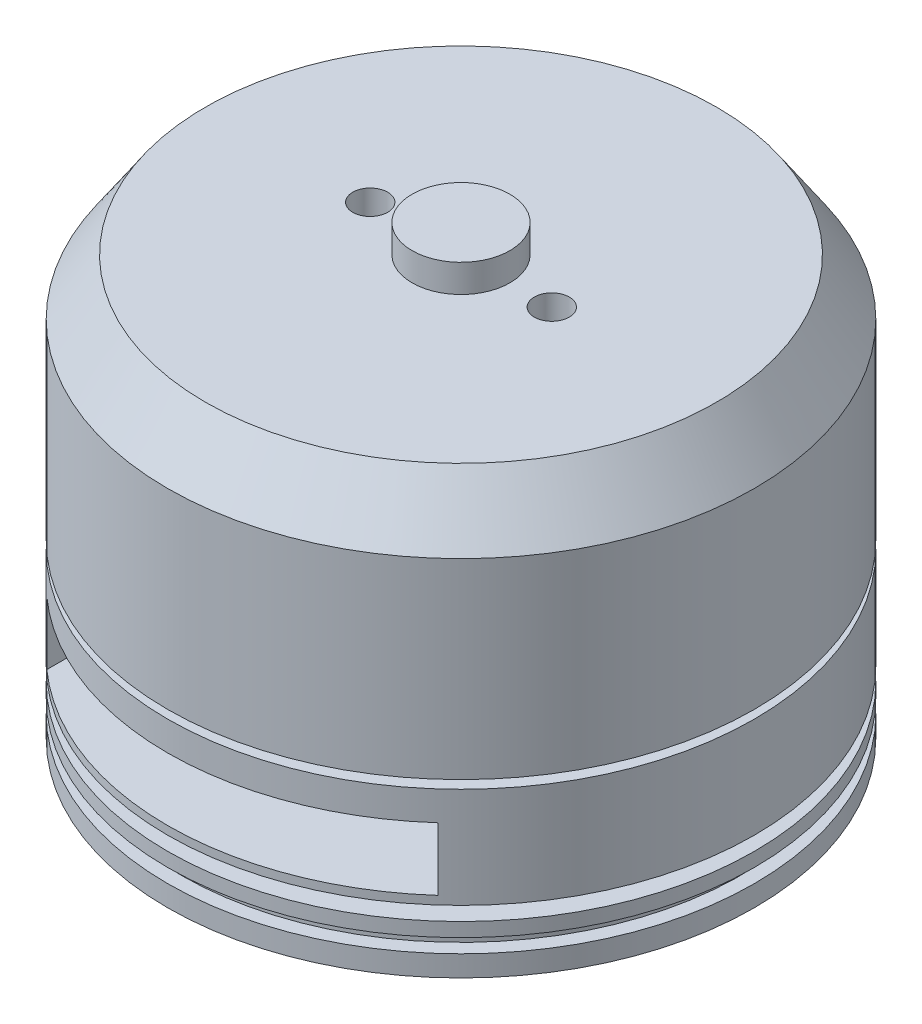
from build123d import *

# Parameters (mm, degrees)
SKETCH_2_W             = 28
SKETCH_2_H             = 4.5
CUT_EXTRUDE_1_DEPTH    = 10
HOLE_WIZARD_M3_1_D     = 2.5
HOLE_WIZARD_M3_1_DEPTH = 4
HOLE_WIZARD_M3_1_TIP   = 0.751075774
SKETCH_18_R            = 3.5
CUT_EXTRUDE_3_DEPTH    = 3
CUT_EXTRUDE_START      = -6.7
SKETCH_19_R            = 4.1
CUT_EXTRUDE_4_DEPTH    = 6.7


with BuildPart() as part:
    # 草图1 → 旋转1 (revolve)
    with BuildSketch(Plane.XY, mode=Mode.PRIVATE) as revolve_1_sk:
        Polygon((0, 0), (4.1, 0), (4.1, 6.7), (13.4, 6.7), (13.4, 8.7), (21, 8.7), (21, 10.2), (20, 10.2), (20, 11.2), (21, 11.2), (21, 12.2), (10, 12.2), (10, 13.2), (21, 13.2), (21, 20.4), (5, 20.4), (5, 21), (21, 21), (21, 34.7), (18.3, 38.7), (3.5, 38.7), (3.5, 43.7), (0, 43.7), align=None)
    revolve(revolve_1_sk.sketch.rotate(Axis((0, 43.7, 0), (0, -1, 0)), 90), axis=Axis((0, 43.7, 0), (0, -1, 0)))

    # 草图2 → 切除-拉伸1 (cut)
    with BuildSketch(Plane.XY.offset(21)):
        with Locations((0, 16.05)):
            Rectangle(SKETCH_2_W, SKETCH_2_H)
    extrude(amount=-CUT_EXTRUDE_1_DEPTH, mode=Mode.SUBTRACT)

    # M3 螺纹孔1
    with Locations(Plane(origin=(0, 38.7, 0), x_dir=(1, 0, 0), z_dir=(0, 1, 0))):
        with Locations((-6.5, 0), (6.5, 0)):
            Hole(HOLE_WIZARD_M3_1_D / 2, depth=HOLE_WIZARD_M3_1_DEPTH)
            with Locations((0, 0, -(HOLE_WIZARD_M3_1_DEPTH + HOLE_WIZARD_M3_1_TIP / 2))):  # 118° drill point
                Cone(0, HOLE_WIZARD_M3_1_D / 2, HOLE_WIZARD_M3_1_TIP, mode=Mode.SUBTRACT)

    # 草图18 → 切除-拉伸3 (cut)
    with BuildSketch(Plane(origin=(0, 43.7, 0), x_dir=(1, 0, 0), z_dir=(0, 1, 0))):
        with Locations(Location((0, 0, 0), (0, 0, 270))):
            Circle(SKETCH_18_R)
    extrude(amount=-CUT_EXTRUDE_3_DEPTH, mode=Mode.SUBTRACT)

    # 草图19 → 切除-拉伸4 (cut)
    with BuildSketch(Plane.XZ.offset(CUT_EXTRUDE_START)):
        Circle(SKETCH_19_R)
    extrude(amount=CUT_EXTRUDE_4_DEPTH, mode=Mode.SUBTRACT)


solid = part.part
